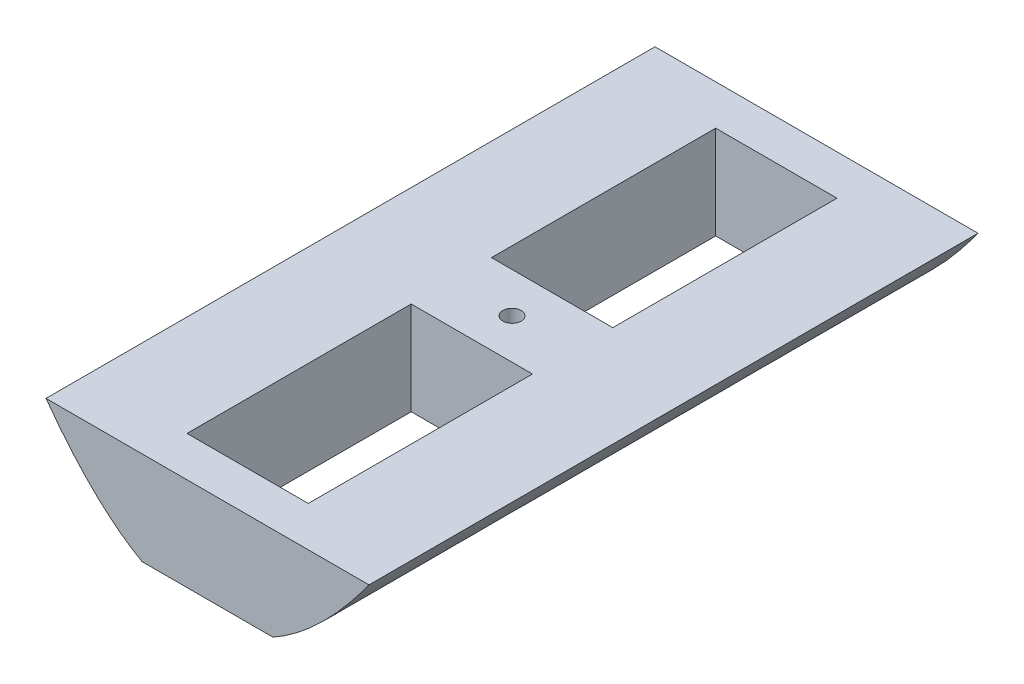
from build123d import *

# Parameters (mm, degrees)
BOSS_EXTRUDE2_DEPTH = 331.382
SKETCH3_R           = 5
SKETCH3_W           = 66
SKETCH3_H           = 122
CUT_EXTRUDE2_DEPTH  = 377.924435453
SKETCH4_W           = 80
SKETCH4_H           = 10
CUT_EXTRUDE3_DEPTH  = 377.924435453
SKETCH5_W           = 260
SKETCH5_H           = 70
CUT_EXTRUDE4_DEPTH  = 377.924435453


with BuildPart() as part:
    # Sketch2 → Boss-Extrude2 (new body)
    with BuildSketch(Plane.XY):
        with BuildLine():
            Line((-127, 127), (127, 127))
            add(Edge.make_bspline(
                [(-127, 127), (0, -127), (127, 127)],
                knots=[0.056028396, 0.056028396, 0.056028396, 0.943971604, 0.943971604, 0.943971604], degree=2))
        make_face()
    extrude(amount=BOSS_EXTRUDE2_DEPTH)

    # Sketch3 → Cut-Extrude2 (cut, through all)
    with BuildSketch(Plane(origin=(0, 127, 0), x_dir=(1, 0, 0), z_dir=(0, 1, 0))):
        with Locations(Location((0, -165.691, 0), (0, 0, 270))):
            Circle(SKETCH3_R)
        with Locations((0, -82.8455)):
            Rectangle(SKETCH3_W, SKETCH3_H)
        with Locations((0, -248.5365)):
            Rectangle(SKETCH3_W, SKETCH3_H)
    extrude(amount=-CUT_EXTRUDE2_DEPTH, mode=Mode.SUBTRACT)

    # Sketch4 → Cut-Extrude3 (cut, through all)
    with BuildSketch(Plane(origin=(0, 0, 0), x_dir=(-1, 0, 0), z_dir=(0, 0, -1))):
        with Locations((0, 5)):
            Rectangle(SKETCH4_W, SKETCH4_H)
    extrude(amount=-CUT_EXTRUDE3_DEPTH, mode=Mode.SUBTRACT)

    # Sketch5 → Cut-Extrude4 (cut, through all)
    with BuildSketch(Plane.XY.offset(331.382)):
        with Locations((0, 95.8)):
            Rectangle(SKETCH5_W, SKETCH5_H)
    extrude(amount=-CUT_EXTRUDE4_DEPTH, mode=Mode.SUBTRACT)


solid = part.part
